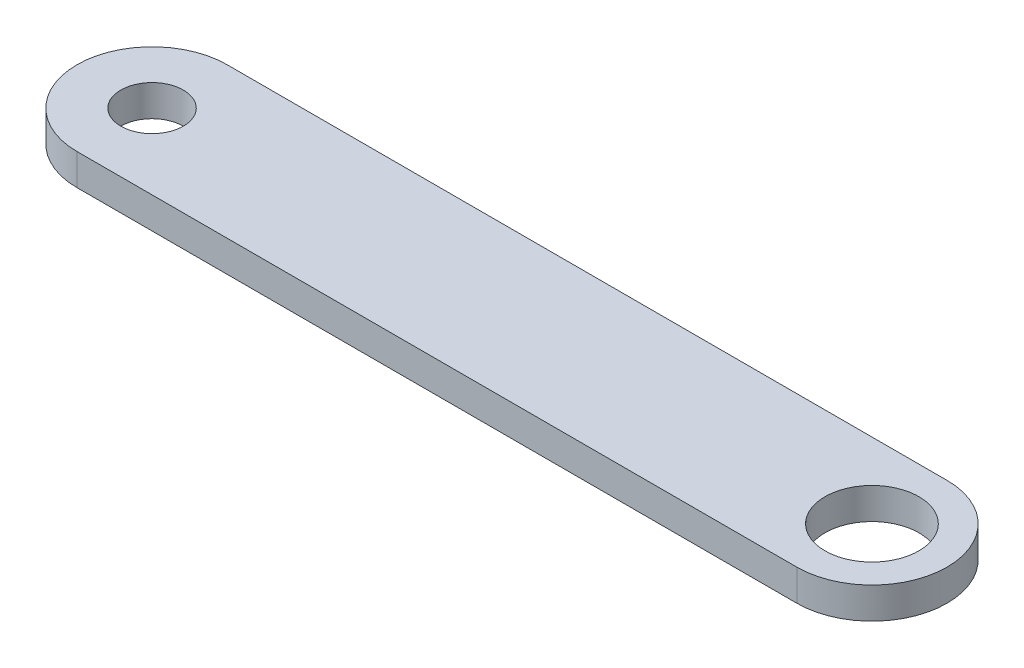
from build123d import *

# Parameters (mm, degrees)
SKETCH1_R           = 5
SKETCH1_R_2         = 7.5
BOSS_EXTRUDE1_DEPTH = 5
SCALE2_SCALE        = 0.2004


with BuildPart() as part:
    # Sketch1 → Boss-Extrude1 (new body)
    with BuildSketch(Plane(origin=(0, 0, 0), x_dir=(1, 0, 0), z_dir=(0, 1, 0))):
        with BuildLine():
            Line((-57.5, 12), (57.5, 12))
            ThreePointArc((57.5, 12), (69.5, 0), (57.5, -12))
            Line((57.5, -12), (-57.5, -12))
            ThreePointArc((-57.5, -12), (-69.5, 0), (-57.5, 12))
        make_face()
        with Locations(Location((-57.5, 0, 0), (0, 0, 270))):
            Circle(SKETCH1_R, mode=Mode.SUBTRACT)
        with Locations(Location((57.5, 0, 0), (0, 0, 270))):
            Circle(SKETCH1_R_2, mode=Mode.SUBTRACT)
    extrude(amount=BOSS_EXTRUDE1_DEPTH)


with BuildPart() as part_1:
    # Scale2: scaled about (-1.908958981, 2.5, 0)
    add(part.part.scale(SCALE2_SCALE).moved(Location((-1.526403601, 1.999, 0))))


solid = part_1.part
